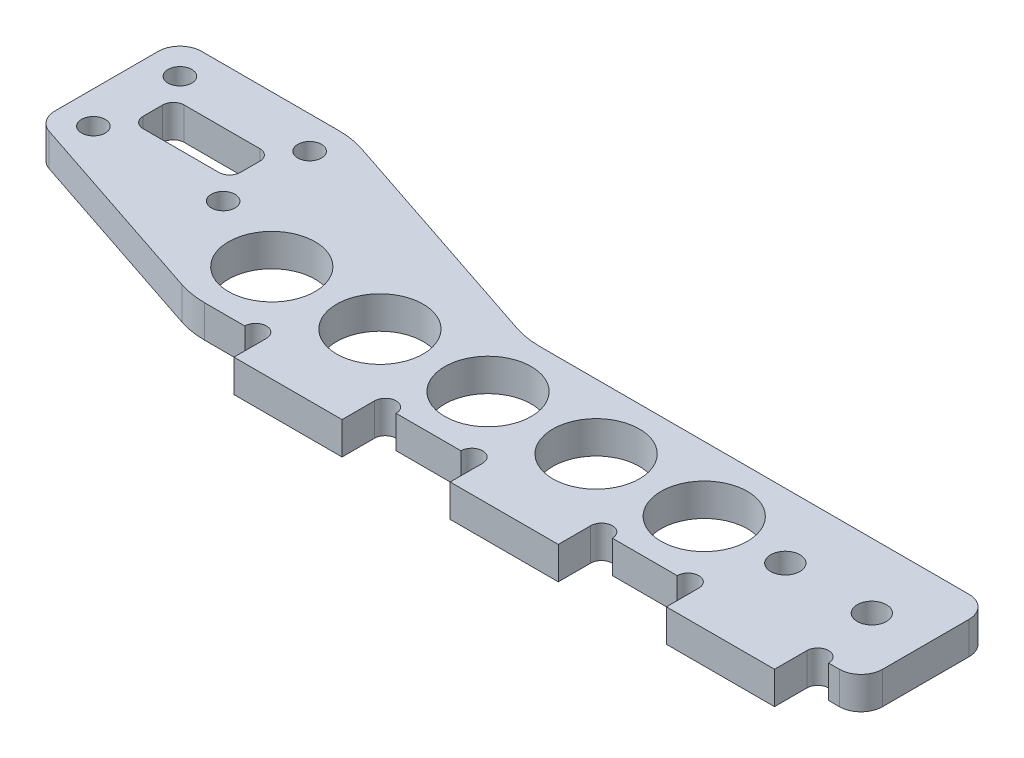
from build123d import *

# Parameters (mm, degrees)
SKETCH_1_W          = 83
SKETCH_1_H          = 12
EXTRUDE_1_DEPTH     = 3
SKETCH_2_W          = 10
SKETCH_2_H          = 3
EXTRUDE_2_DEPTH     = 3
SKETCH_3_R          = 1
CUT_EXTRUDE_1_DEPTH = 43.570529712
SKETCH_4_R          = 1.35
CUT_EXTRUDE_2_DEPTH = 43.570529712
CUT_EXTRUDE_3_DEPTH = 43.570529712
EXTRUDE_3_DEPTH     = 3
SKETCH_9_R          = 1.1
SKETCH_9_W          = 9
SKETCH_9_H          = 3.8
CUT_EXTRUDE_6_DEPTH = 44.900455579
SKETCH_8_R          = 4
CUT_EXTRUDE_5_DEPTH = 44.900455579
FILLET_1_R          = 8
FILLET_2_R          = 2
FILLET_3_R          = 1


with BuildPart() as part:
    # 草图1 → 凸台-拉伸1 (new body)
    with BuildSketch(Plane(origin=(0, 0, 0), x_dir=(1, 0, 0), z_dir=(0, 1, 0))):
        Rectangle(SKETCH_1_W, SKETCH_1_H)
    extrude(amount=EXTRUDE_1_DEPTH)

    # 草图2 → 凸台-拉伸2 (add)
    with BuildSketch(Plane(origin=(0, 3, 0), x_dir=(1, 0, 0), z_dir=(0, 1, 0))):
        with Locations((11.5, -7.5)):
            Rectangle(SKETCH_2_W, SKETCH_2_H)
        with Locations((-8.5, -7.5)):
            Rectangle(SKETCH_2_W, SKETCH_2_H)
        with Locations((31.5, -7.5)):
            Rectangle(SKETCH_2_W, SKETCH_2_H)
    extrude(amount=-EXTRUDE_2_DEPTH)

    # 草图3 → 切除-拉伸1 (cut, through all)
    with BuildSketch(Plane.XZ):
        with Locations((17.5, 6)):
            Circle(SKETCH_3_R)
        with Locations((5.5, 6)):
            Circle(SKETCH_3_R)
        with Locations((-2.5, 6)):
            Circle(SKETCH_3_R)
        with Locations((-14.5, 6)):
            Circle(SKETCH_3_R)
        with Locations((25.5, 6)):
            Circle(SKETCH_3_R)
        with Locations((37.5, 6)):
            Circle(SKETCH_3_R)
    extrude(amount=-CUT_EXTRUDE_1_DEPTH, mode=Mode.SUBTRACT)

    # 草图4 → 切除-拉伸2 (cut, through all)
    with BuildSketch(Plane(origin=(0, 3, 0), x_dir=(1, 0, 0), z_dir=(0, 1, 0))):
        with Locations(Location((28.5, 0, 0), (0, 0, 270))):
            Circle(SKETCH_4_R)
        with Locations(Location((36.5, 0, 0), (0, 0, 270))):
            Circle(SKETCH_4_R)
    extrude(amount=-CUT_EXTRUDE_2_DEPTH, mode=Mode.SUBTRACT)

    # 草图6 → 切除-拉伸3 (cut, through all)
    with BuildSketch(Plane(origin=(0, 3, 0), x_dir=(1, 0, 0), z_dir=(0, 1, 0))):
        Polygon((-41.5, 1), (-20.5, -6), (-41.5, -6), align=None)
    extrude(amount=-CUT_EXTRUDE_3_DEPTH, mode=Mode.SUBTRACT)

    # 草图5 → 凸台-拉伸3 (add)
    with BuildSketch(Plane(origin=(0, 3, 0), x_dir=(1, 0, 0), z_dir=(0, 1, 0))):
        Polygon((-41.5, 14), (-25.5, 14), (-1.5, 6), (-41.5, 6), align=None)
    extrude(amount=-EXTRUDE_3_DEPTH)

    # 草图9 → 切除-拉伸6 (cut, through all)
    with BuildSketch(Plane(origin=(0, 3, 0), x_dir=(1, 0, 0), z_dir=(0, 1, 0))):
        with Locations(Location((-38.5, 11, 0), (0, 0, 270))):
            Circle(SKETCH_9_R)
        with Locations(Location((-38.5, 3, 0), (0, 0, 270))):
            Circle(SKETCH_9_R)
        with Locations(Location((-26.5, 3, 0), (0, 0, 270))):
            Circle(SKETCH_9_R)
        with Locations(Location((-26.5, 11, 0), (0, 0, 270))):
            Circle(SKETCH_9_R)
        with Locations((-32.5, 7)):
            Rectangle(SKETCH_9_W, SKETCH_9_H)
    extrude(amount=-CUT_EXTRUDE_6_DEPTH, mode=Mode.SUBTRACT)

    # 草图8 → 切除-拉伸5 (cut, through all)
    with BuildSketch(Plane(origin=(0, 3, 0), x_dir=(1, 0, 0), z_dir=(0, 1, 0))):
        with Locations(Location((11, 0, 0), (0, 0, 270))):
            Circle(SKETCH_8_R)
        with Locations(Location((1, 0, 0), (0, 0, 270))):
            Circle(SKETCH_8_R)
        with Locations(Location((-9, 0, 0), (0, 0, 270))):
            Circle(SKETCH_8_R)
        with Locations(Location((-19, 0, 0), (0, 0, 270))):
            Circle(SKETCH_8_R)
        with Locations(Location((21, 0, 0), (0, 0, 270))):
            Circle(SKETCH_8_R)
    extrude(amount=-CUT_EXTRUDE_5_DEPTH, mode=Mode.SUBTRACT)

    # 圆角1
    fillet_1_edges = [part.edges().sort_by_distance(p)[0] for p in [
        (-20.5, 1.5, 6),
        (-25.5, 1.5, -14),
        (-1.5, 1.5, -6),
    ]]
    fillet(fillet_1_edges, radius=FILLET_1_R)

    # 圆角2
    fillet_2_edges = [part.edges().sort_by_distance(p)[0] for p in [
        (-41.5, 1.5, -1),
        (-41.5, 1.5, -14),
        (41.5, 1.5, 6),
        (41.5, 1.5, -6),
    ]]
    fillet(fillet_2_edges, radius=FILLET_2_R)

    # 圆角3
    fillet_3_edges = [part.edges().sort_by_distance(p)[0] for p in [
        (-28, 1.5, -8.9),
        (-28, 1.5, -5.1),
        (-37, 1.5, -5.1),
        (-37, 1.5, -8.9),
    ]]
    fillet(fillet_3_edges, radius=FILLET_3_R)


solid = part.part
